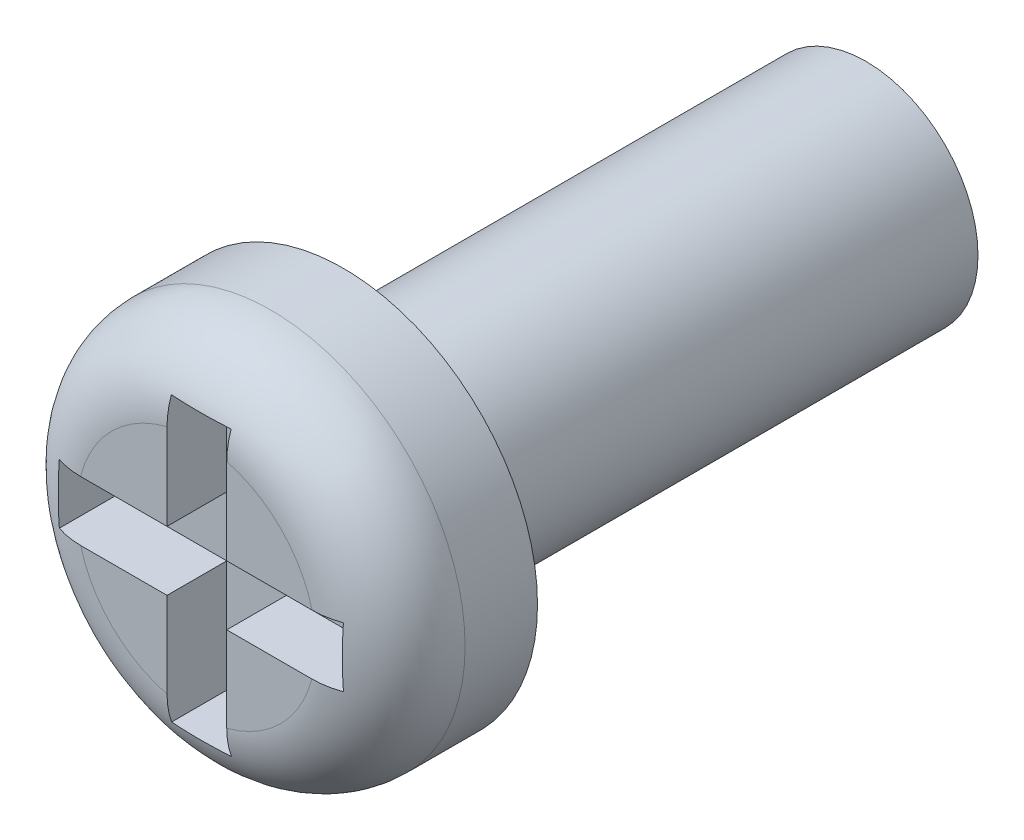
from build123d import *

# Parameters (mm, degrees)
SKETCH1_R           = 2.6
BOSS_EXTRUDE1_DEPTH = 1.97
SKETCH2_R           = 1.5
BOSS_EXTRUDE2_DEPTH = 7
FILLET1_R           = 1
CUT_EXTRUDE1_DEPTH  = 0.8


with BuildPart() as part:
    # Sketch1 → Boss-Extrude1 (new body)
    with BuildSketch(Plane.XY):
        Circle(SKETCH1_R)
    extrude(amount=BOSS_EXTRUDE1_DEPTH)

    # Sketch2 → Boss-Extrude2 (add)
    with BuildSketch(Plane(origin=(0, 0, 0), x_dir=(-1, 0, 0), z_dir=(0, 0, -1))):
        Circle(SKETCH2_R)
    extrude(amount=BOSS_EXTRUDE2_DEPTH)

    # Fillet1
    fillet1_edges = [part.edges().sort_by_distance(p)[0] for p in [
        (-2.6, 0, 1.97),
    ]]
    fillet(fillet1_edges, radius=FILLET1_R)

    # Sketch3 → Cut-Extrude1 (cut)
    with BuildSketch(Plane.XY.offset(1.97)):
        Polygon((-0.392282833, 0.394745479), (-0.392282833, 1.894745479), (0.407717167, 1.894745479), (0.407717167, 0.394745479), (1.907717167, 0.394745479), (1.907717167, -0.405254521), (0.407717167, -0.405254521), (0.407717167, -1.905254521), (-0.392282833, -1.905254521), (-0.392282833, -0.405254521), (-1.892282833, -0.405254521), (-1.892282833, 0.394745479), align=None)
    extrude(amount=-CUT_EXTRUDE1_DEPTH, mode=Mode.SUBTRACT)


solid = part.part
